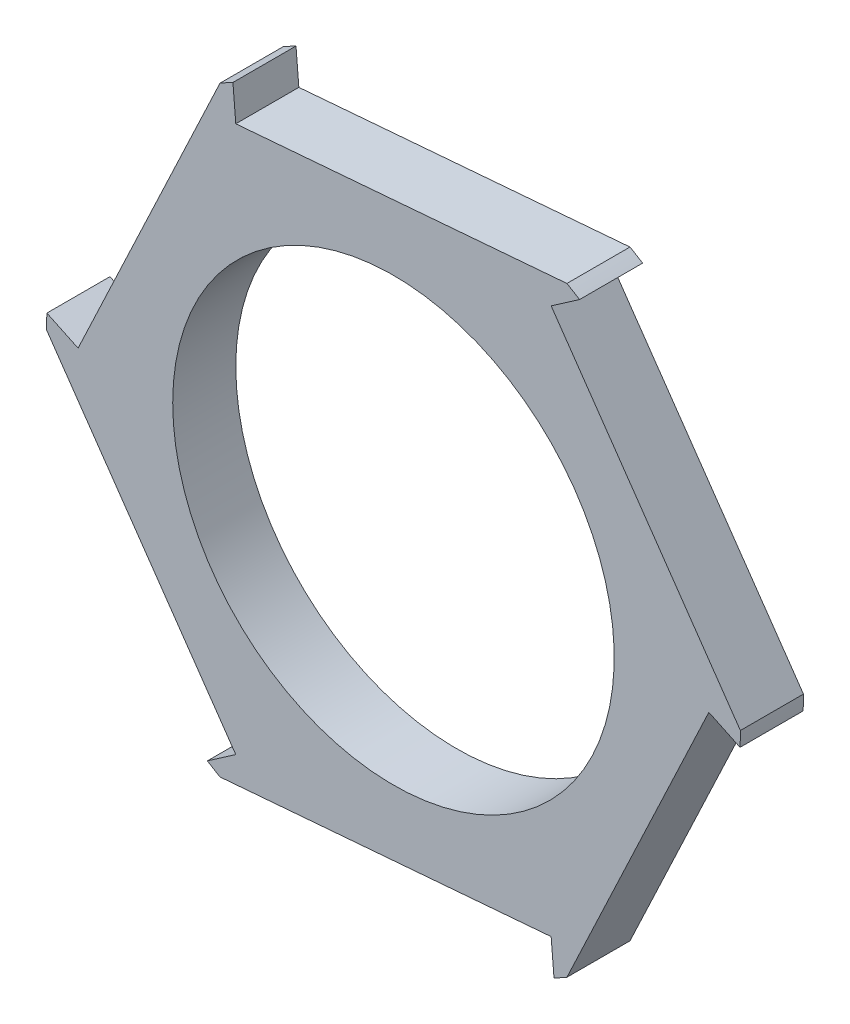
from build123d import *

# Parameters (mm, degrees)
BOSS_EXTRUDE1_DEPTH = 20
SKETCH7_R           = 70
CUT_EXTRUDE1_DEPTH  = 149.354929298


with BuildPart() as part:
    # Sketch4 → Boss-Extrude1 (new body)
    with BuildSketch(Plane.XY):
        Polygon((-50, -86.602540378), (50, -86.602540378), (100, 0), (50, 86.602540378), (-50, 86.602540378), (-100, 0), align=None)
        Polygon((-50, -86.602540378), (-110, 0), (-100, 0), align=None)
        Polygon((-100, 0), (-55, 95.262794416), (-50, 86.602540378), align=None)
        Polygon((-50, 86.602540378), (55, 95.262794416), (50, 86.602540378), align=None)
        Polygon((50, 86.602540378), (110, 0), (100, 0), align=None)
        Polygon((100, 0), (55, -95.262794416), (50, -86.602540378), align=None)
        Polygon((50, -86.602540378), (-55, -95.262794416), (-50, -86.602540378), align=None)
        with BuildLine():
            Line((-55, 95.262794416), (-50, 86.602540378))
            Line((-50, 86.602540378), (-50.900048654, 97.515050362))
            ThreePointArc((-50.900048654, 97.515050362), (-52.961998078, 96.410719111), (-55, 95.262794416))
        make_face()
        with BuildLine():
            Line((55, 95.262794416), (50, 86.602540378))
            Line((50, 86.602540378), (59.000486538, 92.838260369))
            ThreePointArc((59.000486538, 92.838260369), (57.013132909, 94.071795327), (55, 95.262794416))
        make_face()
        with BuildLine():
            Line((110, 0), (100, 0))
            Line((100, 0), (109.900535191, -4.676789993))
            ThreePointArc((109.900535191, -4.676789993), (109.975130987, -2.338923785), (110, 0))
        make_face()
        with BuildLine():
            Line((55, -95.262794416), (50, -86.602540378))
            Line((50, -86.602540378), (50.900048654, -97.515050362))
            ThreePointArc((50.900048654, -97.515050362), (52.961998078, -96.410719111), (55, -95.262794416))
        make_face()
        with BuildLine():
            Line((-55, -95.262794416), (-50, -86.602540378))
            Line((-50, -86.602540378), (-59.000486538, -92.838260369))
            ThreePointArc((-59.000486538, -92.838260369), (-57.013132909, -94.071795327), (-55, -95.262794416))
        make_face()
        with BuildLine():
            Line((-110, 0), (-100, 0))
            Line((-100, 0), (-109.900535191, 4.676789993))
            ThreePointArc((-109.900535191, 4.676789993), (-109.975130987, 2.338923785), (-110, 0))
        make_face()
    extrude(amount=BOSS_EXTRUDE1_DEPTH)

    # Sketch7 → Cut-Extrude1 (cut, through all)
    with BuildSketch(Plane(origin=(0, 0, 0), x_dir=(-1, 0, 0), z_dir=(0, 0, -1))):
        Circle(SKETCH7_R)
    extrude(amount=-CUT_EXTRUDE1_DEPTH, mode=Mode.SUBTRACT)


solid = part.part
